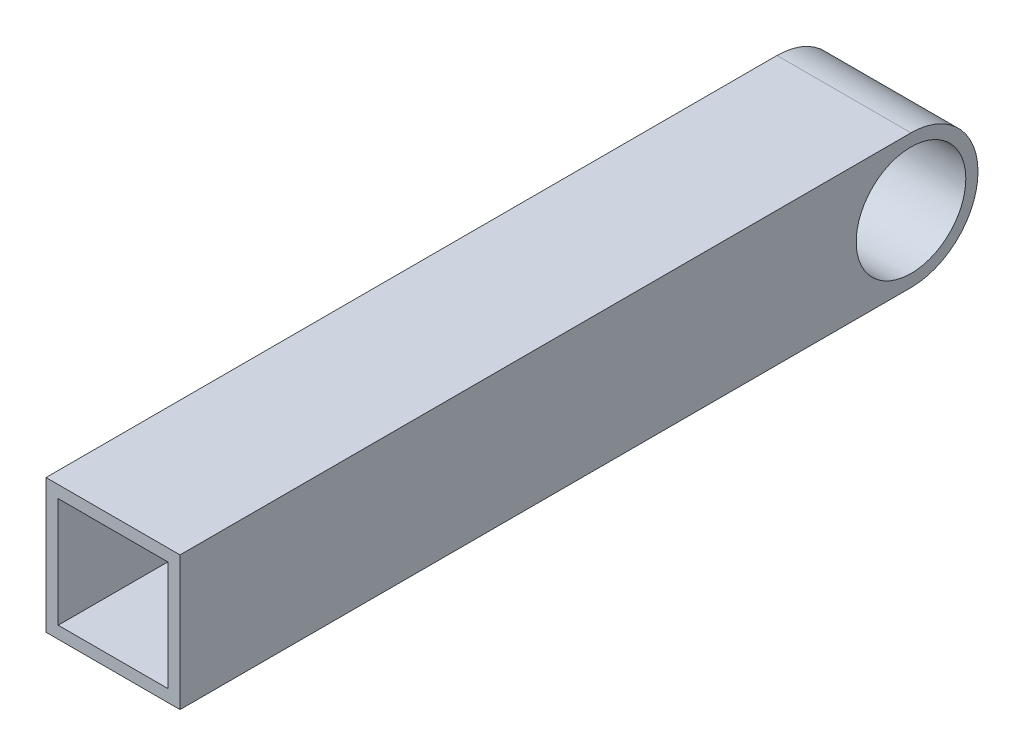
from build123d import *

# Parameters (mm, degrees)
SKETCH1_W           = 55
SKETCH1_H           = 55
BOSS_EXTRUDE1_DEPTH = 327.5
SKETCH2_R           = 22.5
CUT_EXTRUDE1_DEPTH  = 55
CUT_EXTRUDE2_DEPTH  = 55
SKETCH4_W           = 45
SKETCH4_H           = 45
CUT_EXTRUDE3_DEPTH  = 280


with BuildPart() as part:
    # Sketch1 → Boss-Extrude1 (new body)
    with BuildSketch(Plane.XY):
        Rectangle(SKETCH1_W, SKETCH1_H)
    extrude(amount=BOSS_EXTRUDE1_DEPTH)

    # Sketch2 → Cut-Extrude1 (cut)
    with BuildSketch(Plane(origin=(27.5, 0, 0), x_dir=(0, 0, -1), z_dir=(1, 0, 0))):
        with Locations((-27.5, 0)):
            Circle(SKETCH2_R)
    extrude(amount=-CUT_EXTRUDE1_DEPTH, mode=Mode.SUBTRACT)

    # Sketch3 → Cut-Extrude2 (cut)
    with BuildSketch(Plane(origin=(27.5, 0, 0), x_dir=(0, 0, -1), z_dir=(1, 0, 0))):
        with BuildLine():
            Line((0, 27.5), (-27.5, 27.5))
            ThreePointArc((-27.5, 27.5), (-8.054563517, 19.445436483), (0, 0))
            Line((0, 0), (0, 27.5))
        make_face()
        with BuildLine():
            Line((0, -27.5), (0, 0))
            ThreePointArc((0, 0), (-8.054563517, -19.445436483), (-27.5, -27.5))
            Line((-27.5, -27.5), (0, -27.5))
        make_face()
    extrude(amount=-CUT_EXTRUDE2_DEPTH, mode=Mode.SUBTRACT)

    # Sketch4 → Cut-Extrude3 (cut)
    with BuildSketch(Plane.XY.offset(327.5)):
        Rectangle(SKETCH4_W, SKETCH4_H)
    extrude(amount=-CUT_EXTRUDE3_DEPTH, mode=Mode.SUBTRACT)


solid = part.part
